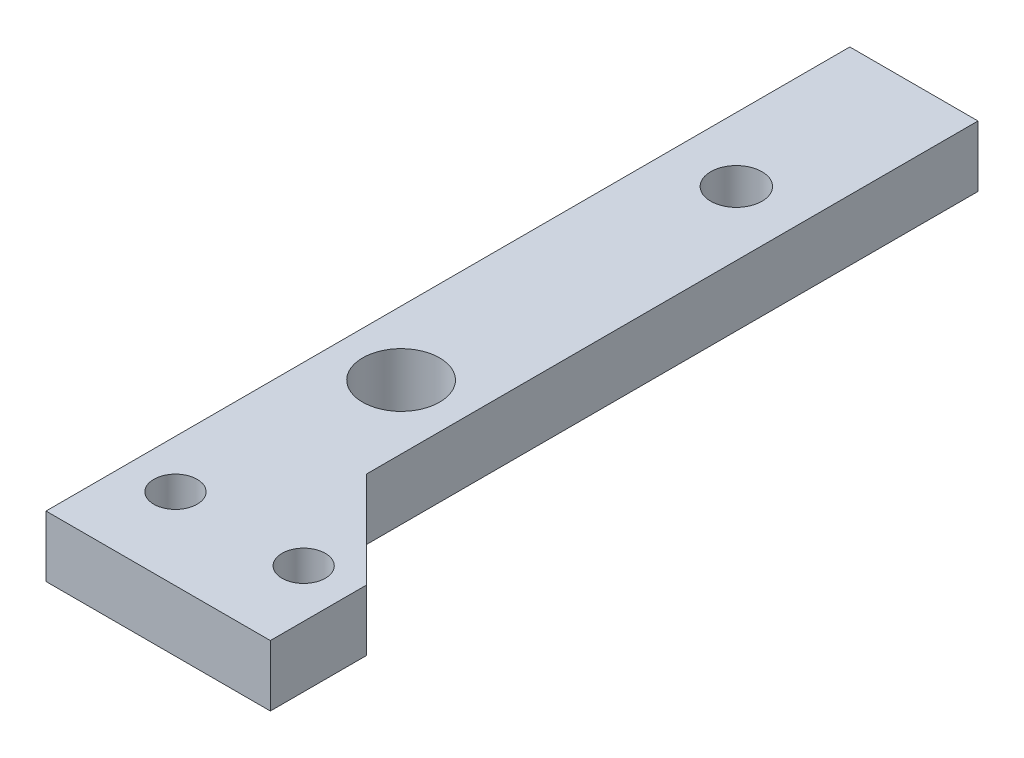
from build123d import *

# Parameters (mm, degrees)
SKETCH2_W               = 20
SKETCH2_H               = 100
SKETCH2_R               = 6
SKETCH2_R_2             = 4
BOSS_EXTRUDE1_DEPTH     = 9.525
SKETCH4_W               = 20
SKETCH4_H               = 25.4
BOSS_EXTRUDE2_DEPTH     = 9.525
BOSS_EXTRUDE3_DEPTH     = 9.525
F_1_4_CLEARANCE_HOLE2_D = 6.7564


with BuildPart() as part:
    # Sketch2 → Boss-Extrude1 (new body)
    with BuildSketch(Plane(origin=(0, 0, 0), x_dir=(1, 0, 0), z_dir=(0, 1, 0))):
        with Locations((10, -50)):
            Rectangle(SKETCH2_W, SKETCH2_H)
        with Locations(Location((10, -80, 0), (0, 0, 90))):
            Circle(SKETCH2_R, mode=Mode.SUBTRACT)
        with Locations(Location((10, -27.7, 0), (0, 0, 90))):
            Circle(SKETCH2_R_2, mode=Mode.SUBTRACT)
    extrude(amount=BOSS_EXTRUDE1_DEPTH)

    # Sketch4 → Boss-Extrude2 (add)
    with BuildSketch(Plane(origin=(0, 9.525, 0), x_dir=(1, 0, 0), z_dir=(0, 1, 0))):
        with Locations((10, -112.7)):
            Rectangle(SKETCH4_W, SKETCH4_H)
    extrude(amount=-BOSS_EXTRUDE2_DEPTH)

    # Sketch8 → Boss-Extrude3 (add)
    with BuildSketch(Plane(origin=(0, 9.525, 0), x_dir=(1, 0, 0), z_dir=(0, 1, 0))):
        Polygon((20, -125.4), (35, -125.4), (35, -110.4), (20, -95.4), align=None)
    extrude(amount=-BOSS_EXTRUDE3_DEPTH)

    # 1/4 Clearance Hole2 (through all)
    with Locations(Plane(origin=(0, 9.525, 0), x_dir=(1, 0, 0), z_dir=(0, 1, 0))):
        with Locations((7.5, -112.7), (27.5, -112.7)):
            Hole(F_1_4_CLEARANCE_HOLE2_D / 2)


solid = part.part
